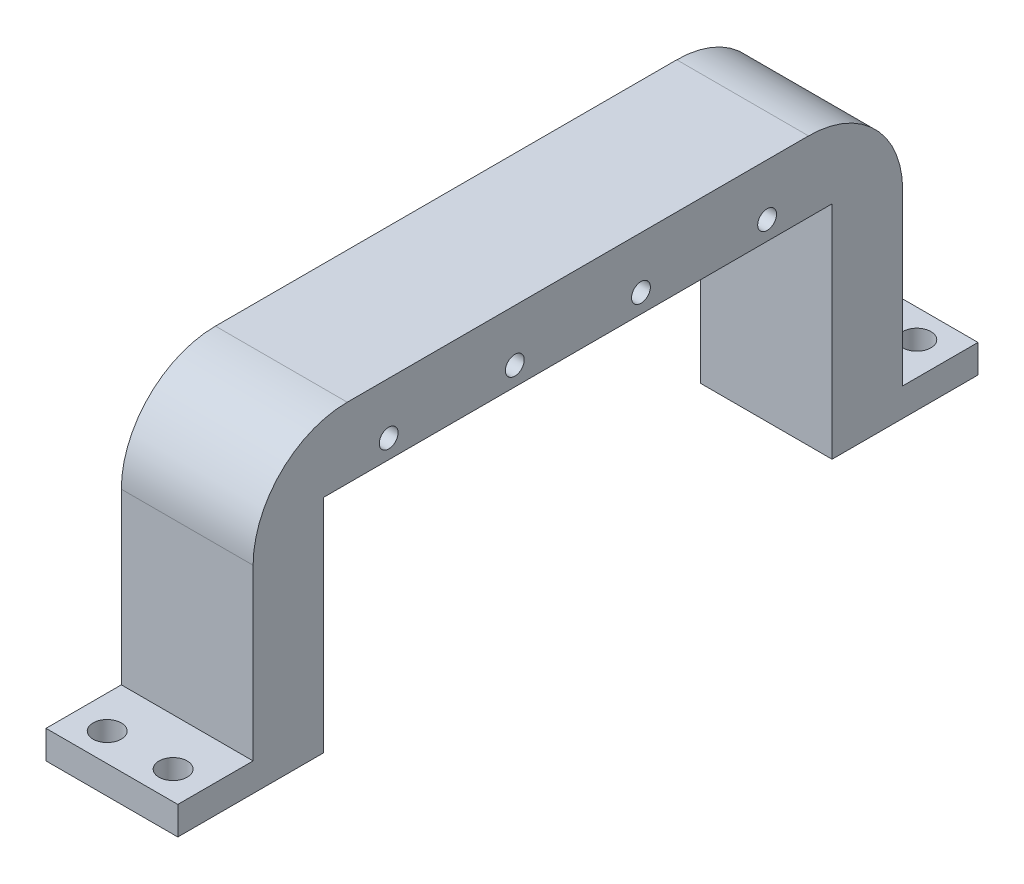
from build123d import *

# Parameters (mm, degrees)
BOSS_EXTRUDE1_DEPTH      = 7
BOSS_EXTRUDE1_DEPTH_BACK = 7
FILLET1_R                = 10
SKETCH2_R                = 1
CUT_EXTRUDE1_DEPTH       = 45.028399926
SKETCH3_R                = 1.5
CUT_EXTRUDE2_DEPTH       = 5
SKETCH4_W                = 14
SKETCH4_H                = 8
SKETCH4_R                = 1.5
BOSS_EXTRUDE2_DEPTH      = 3


with BuildPart() as part:
    # Sketch1 → Boss-Extrude1 (new, two sides: drawn at the far end of the back side and taken through both)
    with BuildSketch(Plane(origin=(0, 0, 0), x_dir=(0, 0, -1), z_dir=(1, 0, 0)).offset(-BOSS_EXTRUDE1_DEPTH_BACK)):
        Polygon((-27, 0), (27, 0), (27, -23.5), (34.5, -23.5), (34.5, 7.5), (-34.5, 7.5), (-34.5, -23.5), (-27, -23.5), align=None)
    extrude(amount=BOSS_EXTRUDE1_DEPTH + BOSS_EXTRUDE1_DEPTH_BACK)

    # Fillet1
    fillet1_edges = [part.edges().sort_by_distance(p)[0] for p in [
        (0, 7.5, 34.5),
        (0, 7.5, -34.5),
    ]]
    fillet(fillet1_edges, radius=FILLET1_R)

    # Sketch2 → Cut-Extrude1 (cut, through all)
    with BuildSketch(Plane(origin=(7, 0, 0), x_dir=(0, 0, -1), z_dir=(1, 0, 0))):
        with Locations((-6.7, 2)):
            Circle(SKETCH2_R)
        with Locations((-20.1, 2)):
            Circle(SKETCH2_R)
        with Locations((20.1, 2)):
            Circle(SKETCH2_R)
        with Locations((6.7, 2)):
            Circle(SKETCH2_R)
    extrude(amount=-CUT_EXTRUDE1_DEPTH, mode=Mode.SUBTRACT)

    # Sketch3 → Cut-Extrude2 (cut)
    with BuildSketch(Plane.XZ.offset(23.5)):
        with Locations((-3.5, -30.75)):
            Circle(SKETCH3_R)
        with Locations((3.5, -30.75)):
            Circle(SKETCH3_R)
        with Locations((-3.5, 30.75)):
            Circle(SKETCH3_R)
        with Locations((3.5, 30.75)):
            Circle(SKETCH3_R)
    extrude(amount=-CUT_EXTRUDE2_DEPTH, mode=Mode.SUBTRACT)

    # Sketch4 → Boss-Extrude2 (add)
    # profile 1 of 2: a face of its own
    with BuildSketch(Plane.XZ.offset(23.5)):
        with Locations((0, 38.5)):
            Rectangle(SKETCH4_W, SKETCH4_H)
        with Locations((-3.5, 39.5)):
            Circle(SKETCH4_R, mode=Mode.SUBTRACT)
        with Locations((3.5, 39.5)):
            Circle(SKETCH4_R, mode=Mode.SUBTRACT)
    # profile 2 of 2: a face of its own
    with BuildSketch(Plane.XZ.offset(23.5)):
        with Locations((0, -38.5)):
            Rectangle(SKETCH4_W, SKETCH4_H)
        with Locations((3.5, -39.5)):
            Circle(SKETCH4_R, mode=Mode.SUBTRACT)
        with Locations((-3.5, -39.5)):
            Circle(SKETCH4_R, mode=Mode.SUBTRACT)
    extrude(amount=-BOSS_EXTRUDE2_DEPTH)


solid = part.part
